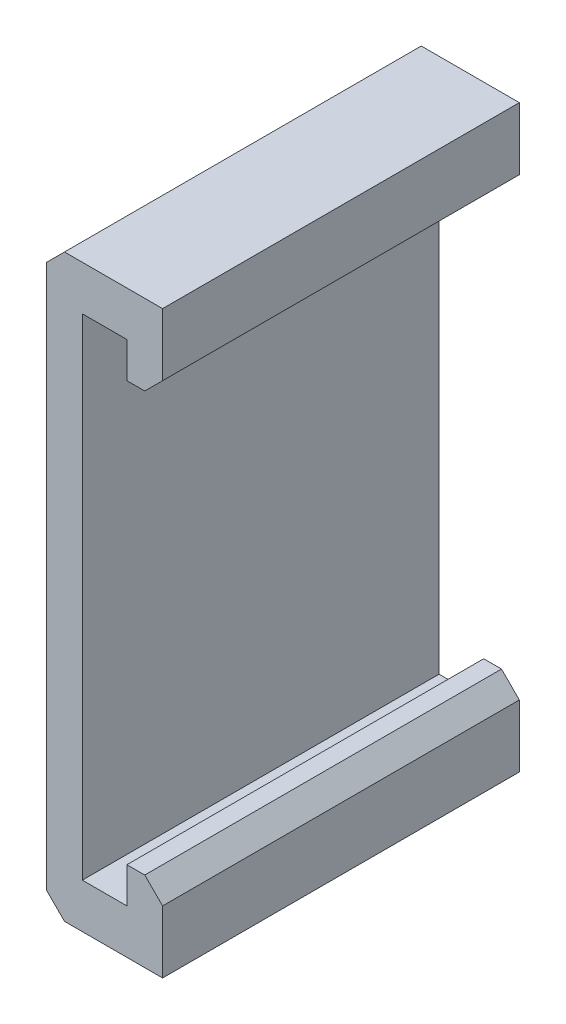
from build123d import *

# Parameters (mm, degrees)
BOSS_EXTRUDE1_DEPTH = 8


with BuildPart() as part:
    # Sketch1 → Boss-Extrude1 (new body)
    with BuildSketch(Plane.XY):
        Polygon((2.2, 21.2), (2.6, 21.6), (2.6, 23), (0.4, 23), (0, 22.6), (0, 10.4), (0.4, 10), (2.6, 10), (2.6, 11.4), (2.2, 11.8), (1.8, 11.8), (1.8, 11), (0.8, 11), (0.8, 22), (1.8, 22), (1.8, 21.2), align=None)
    extrude(amount=-BOSS_EXTRUDE1_DEPTH)


solid = part.part
